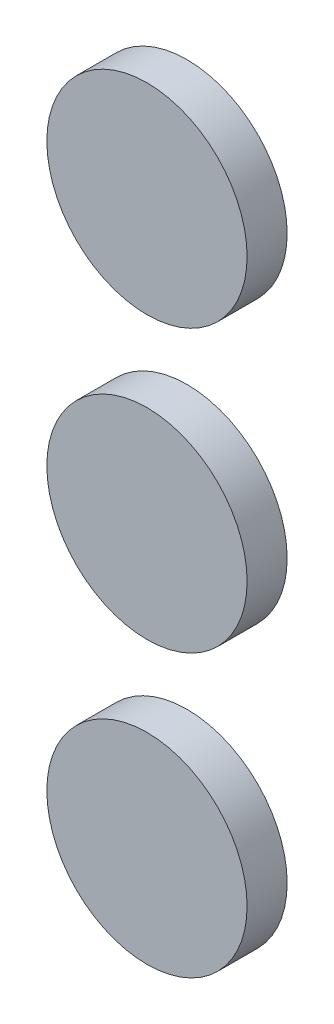
from build123d import *

# Parameters (mm, degrees)
ESQUISSE1_RX         = 1.254332769
ESQUISSE1_RY         = 1.25
BOSS_EXTRU_1_DEPTH   = 0.5
BOSS_EXTRU_1_2_DEPTH = 0.5
BOSS_EXTRU_1_3_DEPTH = 0.5


with BuildPart() as part:
    # Esquisse1 → Boss.-Extru.1 (new body)
    with BuildSketch(Plane.XY):
        with Locations(Location((43.9, 54.242337162), (0, 0, -90))):
            Ellipse(ESQUISSE1_RX, ESQUISSE1_RY)
    extrude(amount=BOSS_EXTRU_1_DEPTH)


with BuildPart() as body_2:
    # Esquisse1 → Boss.-Extru.1 2 (new body)
    with BuildSketch(Plane.XY):
        with Locations(Location((43.9, 57.754468914), (0, 0, -90))):
            Ellipse(ESQUISSE1_RX, ESQUISSE1_RY)
    extrude(amount=BOSS_EXTRU_1_2_DEPTH)


with BuildPart() as body_3:
    # Esquisse1 → Boss.-Extru.1 3 (new body)
    with BuildSketch(Plane.XY):
        with Locations(Location((43.9, 61.266600666), (0, 0, 90))):
            Ellipse(ESQUISSE1_RX, ESQUISSE1_RY)
    extrude(amount=BOSS_EXTRU_1_3_DEPTH)


solid = Compound([part.part, body_2.part, body_3.part])
